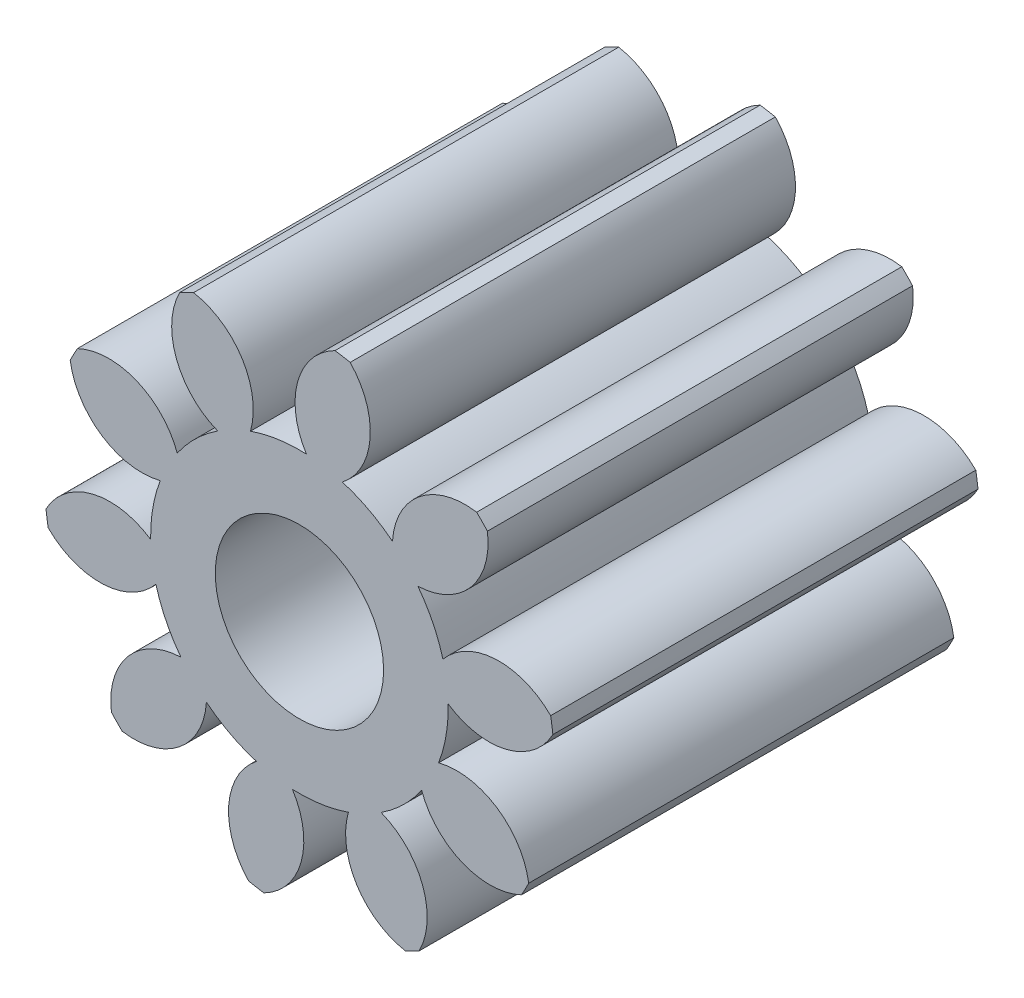
from build123d import *

# Parameters (mm, degrees)
CROQUIS1_R              = 3
CROQUIS1_R_2            = 0.99
SALIENTE_EXTRUIR1_DEPTH = 5
CORTAR_EXTRUIR1_START   = -5
CORTAR_EXTRUIR1_DEPTH   = 5
MATRIZC1_COUNT          = 10


with BuildPart() as part:
    # Croquis1 → Saliente-Extruir1 (new body)
    with BuildSketch(Plane.XY):
        Circle(CROQUIS1_R)
        Circle(CROQUIS1_R_2, mode=Mode.SUBTRACT)
    extrude(amount=SALIENTE_EXTRUIR1_DEPTH)

    # Croquis2 → Cortar-Extruir1 (cut)
    with BuildSketch(Plane.XY.offset(5).offset(CORTAR_EXTRUIR1_START)):
        with BuildLine():
            ThreePointArc((0.417931544, 2.97074624), (-0.430892121, 2.968894067), (-1.245220237, 2.729363765))
            ThreePointArc((-1.245220237, 2.729363765), (-0.671688501, 2.339412764), (-0.575935961, 1.652512562))
            ThreePointArc((-0.575935961, 1.652512562), (-0.251353737, 1.731854872), (0.082392028, 1.748059368))
            ThreePointArc((0.082392028, 1.748059368), (-0.021080122, 2.433839179), (0.417931544, 2.97074624))
        make_face()
    cortar_extruir1 = extrude(amount=CORTAR_EXTRUIR1_DEPTH, mode=Mode.SUBTRACT)

    # MatrizC1: Cortar-Extruir1 ×10 about axis
    matrizc1_axis = Axis((0, 0, 0), (0, 0, 1))
    for i in range(1, MATRIZC1_COUNT):
        add(cortar_extruir1.rotate(matrizc1_axis, i * 360 / MATRIZC1_COUNT), mode=Mode.SUBTRACT)


solid = part.part
